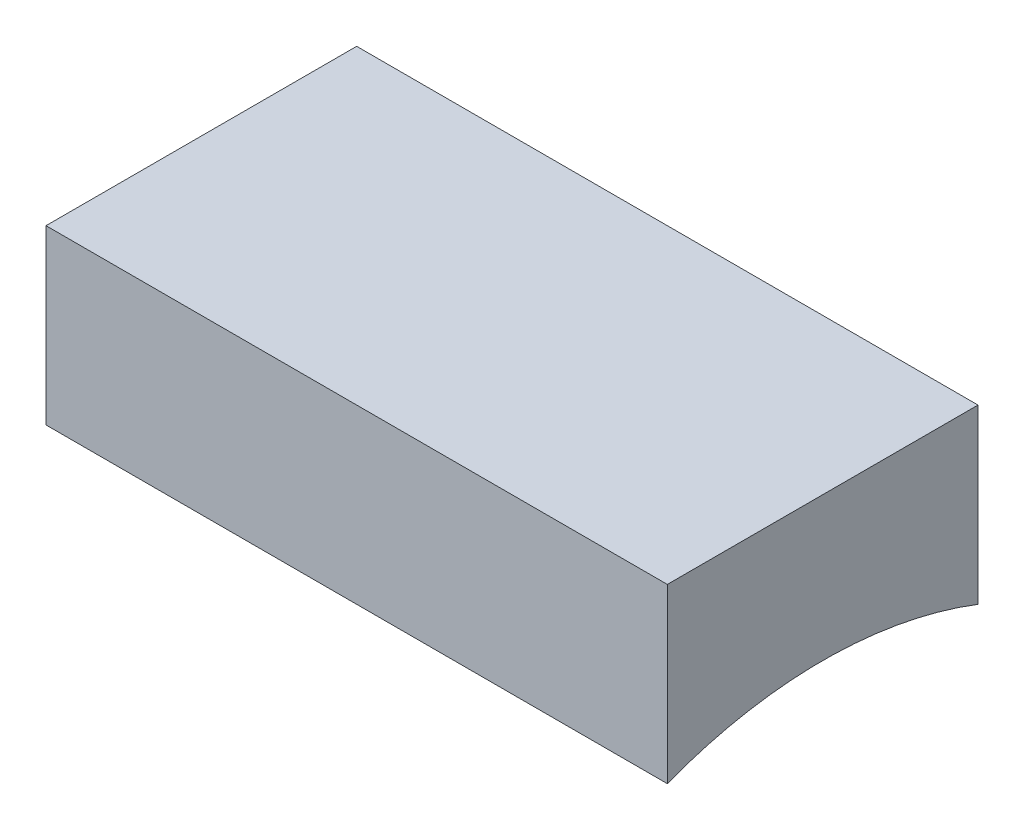
from build123d import *

# Parameters (mm, degrees)
SKETCH1_W           = 18
SKETCH1_H           = 9
BOSS_EXTRUDE1_DEPTH = 5
CUT_EXTRUDE1_DEPTH  = 20.215878851
CUT_EXTRUDE3_DEPTH  = 3.6


with BuildPart() as part:
    # Sketch1 → Boss-Extrude1 (new body)
    with BuildSketch(Plane(origin=(0, 0, 0), x_dir=(1, 0, 0), z_dir=(0, 1, 0))):
        Rectangle(SKETCH1_W, SKETCH1_H)
    extrude(amount=BOSS_EXTRUDE1_DEPTH)

    # Sketch2 → Cut-Extrude1 (cut, through all)
    with BuildSketch(Plane.ZY.offset(9)):
        with BuildLine():
            Line((-4.5, 0), (4.5, 0))
            ThreePointArc((4.5, 0), (0, 0.83809621), (-4.5, 0))
        make_face()
    extrude(amount=-CUT_EXTRUDE1_DEPTH, mode=Mode.SUBTRACT)

    # Sketch3 → Cut-Extrude3 (cut)
    with BuildSketch(Plane(origin=(0, 0, 0), x_dir=(1, 0, 0), z_dir=(0, 1, 0))):
        with BuildLine():
            Line((-9, 2.5), (5.4, 2.5))
            ThreePointArc((5.4, 2.5), (6.53137085, 2.03137085), (7, 0.9))
            Line((7, 0.9), (7, -0.9))
            ThreePointArc((7, -0.9), (6.53137085, -2.03137085), (5.4, -2.5))
            Line((5.4, -2.5), (-9, -2.5))
            Line((-9, -2.5), (-9, 2.5))
        make_face()
    extrude(amount=CUT_EXTRUDE3_DEPTH, mode=Mode.SUBTRACT)


solid = part.part
